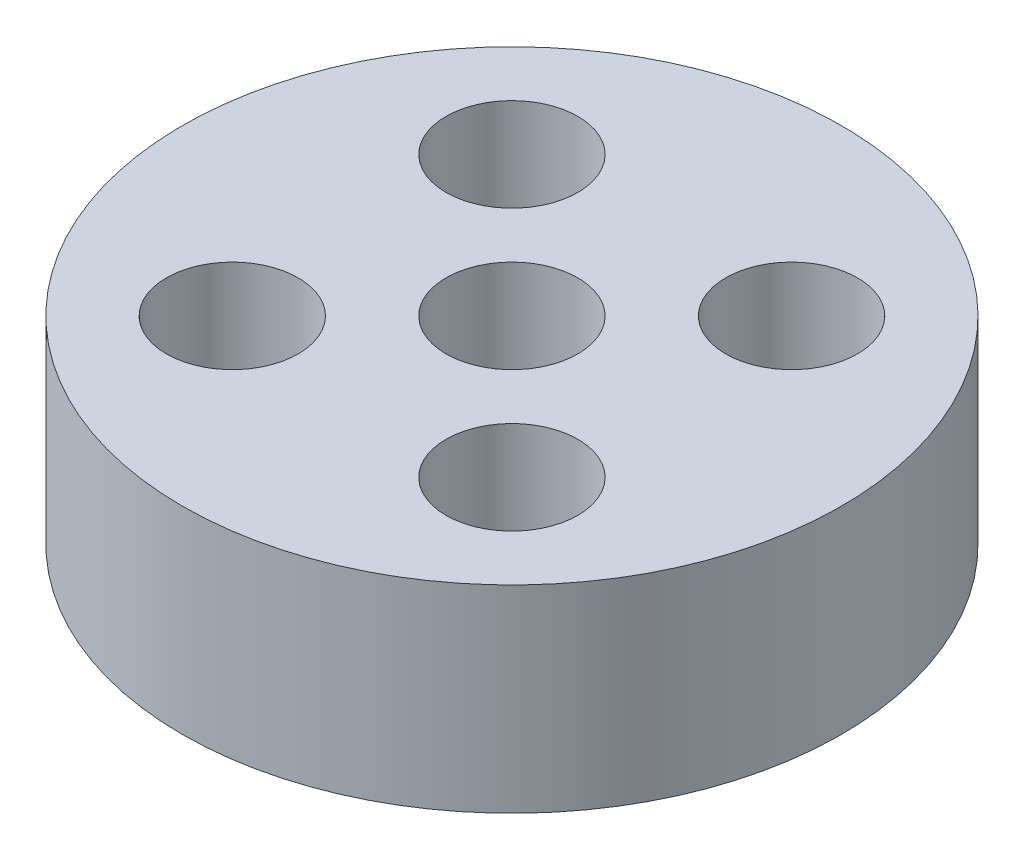
from build123d import *

# Parameters (mm, degrees)
SKETCH1_R           = 25
SKETCH1_R_2         = 5
BOSS_EXTRUDE1_DEPTH = 15
SKETCH2_R           = 5
CUT_EXTRUDE1_DEPTH  = 39.405728739


with BuildPart() as part:
    # Sketch1 → Boss-Extrude1 (new body)
    with BuildSketch(Plane(origin=(0, 0, 0), x_dir=(1, 0, 0), z_dir=(0, 1, 0))):
        with Locations(Location((0, 0, 0), (0, 0, 270))):
            Circle(SKETCH1_R)
        with Locations(Location((10.606601718, 10.606601718, 0), (0, 0, 270))):
            Circle(SKETCH1_R_2, mode=Mode.SUBTRACT)
        with Locations(Location((10.606601718, -10.606601718, 0), (0, 0, 270))):
            Circle(SKETCH1_R_2, mode=Mode.SUBTRACT)
        with Locations(Location((-10.606601718, -10.606601718, 0), (0, 0, 270))):
            Circle(SKETCH1_R_2, mode=Mode.SUBTRACT)
        with Locations(Location((-10.606601718, 10.606601718, 0), (0, 0, 270))):
            Circle(SKETCH1_R_2, mode=Mode.SUBTRACT)
    extrude(amount=BOSS_EXTRUDE1_DEPTH)

    # Sketch2 → Cut-Extrude1 (cut, through all)
    with BuildSketch(Plane(origin=(0, 15, 0), x_dir=(1, 0, 0), z_dir=(0, 1, 0))):
        with Locations(Location((0, 0, 0), (0, 0, 270))):
            Circle(SKETCH2_R)
    extrude(amount=-CUT_EXTRUDE1_DEPTH, mode=Mode.SUBTRACT)


solid = part.part
